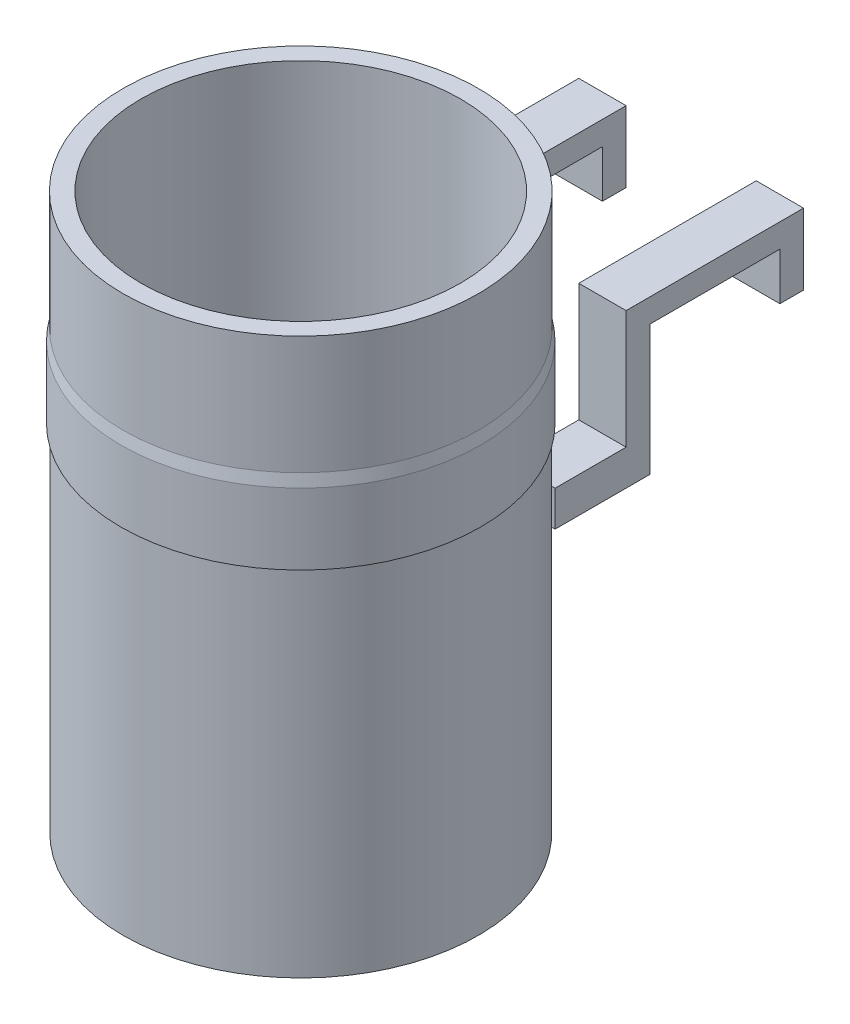
from build123d import *

# Parameters (mm, degrees)
SKETCH1_R                = 75
BOSS_EXTRUDE1_DEPTH      = 150
SKETCH3_R                = 76
BOSS_EXTRUDE3_DEPTH      = 30
SKETCH4_R                = 76
BOSS_EXTRUDE4_DEPTH      = 5
BOSS_EXTRUDE4_TAPER      = 10
SKETCH5_R                = 75.118365096
BOSS_EXTRUDE5_DEPTH      = 50
BOSS_EXTRUDE6_DEPTH      = 20
BOSS_EXTRUDE6_DEPTH_BACK = 20
SKETCH8_W                = 20
SKETCH8_H                = 15
SKETCH9_W                = 20
SKETCH9_H                = 10
BOSS_EXTRUDE7_DEPTH      = 50
SKETCH10_W               = 20
SKETCH10_H               = 10
BOSS_EXTRUDE8_DEPTH      = 65
SKETCH11_W               = 20
SKETCH11_H               = 10
BOSS_EXTRUDE9_DEPTH      = 50
SKETCH12_W               = 20
SKETCH12_H               = 10
BOSS_EXTRUDE10_DEPTH     = 65
SKETCH13_W               = 20
SKETCH13_H               = 10
BOSS_EXTRUDE11_DEPTH     = 20
SKETCH6_R                = 67.5
CUT_EXTRUDE2_DEPTH       = 200


with BuildPart() as part:
    # Sketch1 → Boss-Extrude1 (new body)
    with BuildSketch(Plane(origin=(0, 0, 0), x_dir=(1, 0, 0), z_dir=(0, 1, 0))):
        with Locations((-42.374837203, 0)):
            Circle(SKETCH1_R)
    extrude(amount=BOSS_EXTRUDE1_DEPTH)

    # Sketch3 → Boss-Extrude3 (add)
    with BuildSketch(Plane(origin=(0, 150, 0), x_dir=(1, 0, 0), z_dir=(0, 1, 0))):
        with Locations((-42.374837203, 0)):
            Circle(SKETCH3_R)
    extrude(amount=BOSS_EXTRUDE3_DEPTH)

    # Sketch4 → Boss-Extrude4 (add)
    with BuildSketch(Plane(origin=(0, 180, 0), x_dir=(1, 0, 0), z_dir=(0, 1, 0))):
        with Locations((-42.374837203, 0)):
            Circle(SKETCH4_R)
    extrude(amount=BOSS_EXTRUDE4_DEPTH, taper=BOSS_EXTRUDE4_TAPER)

    # Sketch5 → Boss-Extrude5 (add)
    with BuildSketch(Plane(origin=(0, 185, 0), x_dir=(1, 0, 0), z_dir=(0, 1, 0))):
        with Locations((-42.374837203, 0)):
            Circle(SKETCH5_R)
    extrude(amount=BOSS_EXTRUDE5_DEPTH)

    # Sketch8 → Boss-Extrude6 (add, two sides: drawn at the far end of the back side and taken through both)
    with BuildSketch(Plane.XY.offset(-80).offset(-BOSS_EXTRUDE6_DEPTH_BACK)):
        with Locations((-4.874837203, 112.5)):
            Rectangle(SKETCH8_W, SKETCH8_H)
        with Locations((-79.874837203, 112.5)):
            Rectangle(SKETCH8_W, SKETCH8_H)
    extrude(amount=BOSS_EXTRUDE6_DEPTH + BOSS_EXTRUDE6_DEPTH_BACK)

    # Sketch9 → Boss-Extrude7 (add)
    with BuildSketch(Plane(origin=(0, 120, 0), x_dir=(1, 0, 0), z_dir=(0, 1, 0))):
        with Locations((-4.874837203, 95)):
            Rectangle(SKETCH9_W, SKETCH9_H)
    extrude(amount=BOSS_EXTRUDE7_DEPTH)

    # Sketch10 → Boss-Extrude8 (add)
    with BuildSketch(Plane(origin=(0, 0, -100), x_dir=(-1, 0, 0), z_dir=(0, 0, -1))):
        with Locations((4.874837203, 165)):
            Rectangle(SKETCH10_W, SKETCH10_H)
    extrude(amount=BOSS_EXTRUDE8_DEPTH)

    # Sketch11 → Boss-Extrude9 (add)
    with BuildSketch(Plane(origin=(0, 120, 0), x_dir=(1, 0, 0), z_dir=(0, 1, 0))):
        with Locations((-79.874837203, 95)):
            Rectangle(SKETCH11_W, SKETCH11_H)
    extrude(amount=BOSS_EXTRUDE9_DEPTH)

    # Sketch12 → Boss-Extrude10 (add)
    with BuildSketch(Plane(origin=(0, 0, -100), x_dir=(-1, 0, 0), z_dir=(0, 0, -1))):
        with Locations((79.874837203, 165)):
            Rectangle(SKETCH12_W, SKETCH12_H)
    extrude(amount=BOSS_EXTRUDE10_DEPTH)

    # Sketch13 → Boss-Extrude11 (add)
    with BuildSketch(Plane.XZ.offset(-160)):
        with Locations((-4.874837203, -160)):
            Rectangle(SKETCH13_W, SKETCH13_H)
        with Locations((-79.874837203, -160)):
            Rectangle(SKETCH13_W, SKETCH13_H)
    extrude(amount=BOSS_EXTRUDE11_DEPTH)

    # Sketch6 → Cut-Extrude2 (cut)
    with BuildSketch(Plane(origin=(0, 235, 0), x_dir=(1, 0, 0), z_dir=(0, 1, 0))):
        with Locations((-42.374837203, 0)):
            Circle(SKETCH6_R)
    extrude(amount=-CUT_EXTRUDE2_DEPTH, mode=Mode.SUBTRACT)


solid = part.part
